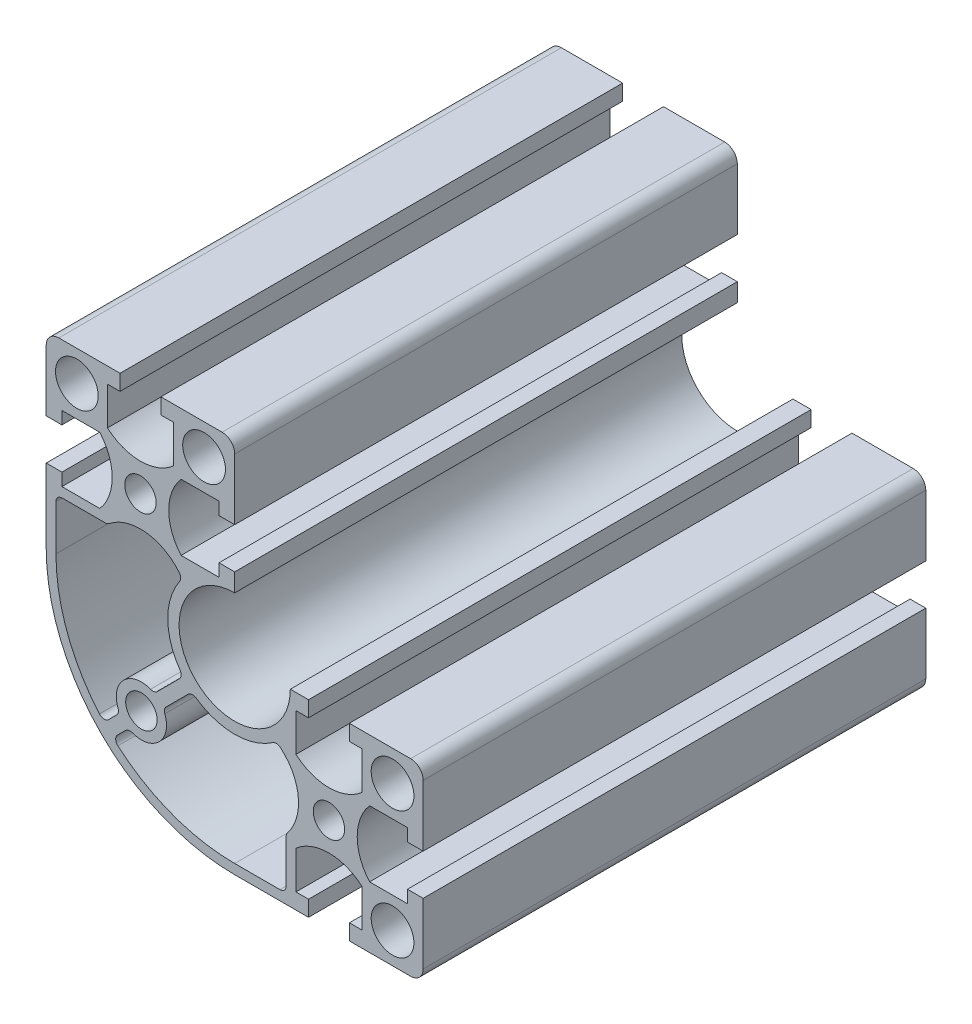
from build123d import *

# Parameters (mm, degrees)
IZIM1_R                     = 3.4
IZIM1_R_2                   = 2.5
Y_KSEKLIK_EKSTR_ZYON1_DEPTH = 80
FILLET1_R                   = 2


with BuildPart() as part:
    # Çizim1 → Yükseklik-Ekstrüzyon1 (new body)
    with BuildSketch(Plane.XY):
        with BuildLine():
            Line((18.25, 0), (30, 0))
            Line((30, 0), (30, -11.75))
            Line((30, -11.75), (27.5, -11.75))
            Line((27.5, -11.75), (27.5, -9.75))
            Line((27.5, -9.75), (21.463651766, -9.75))
            ThreePointArc((21.463651766, -9.75), (19.5, -15), (21.463651766, -20.25))
            Line((21.463651766, -20.25), (27.5, -20.25))
            Line((27.5, -20.25), (27.5, -18.25))
            Line((27.5, -18.25), (30, -18.25))
            Line((30, -18.25), (30, -30))
            Line((30, -30), (18.25, -30))
            Line((18.25, -30), (18.25, -27.5))
            Line((18.25, -27.5), (20.25, -27.5))
            Line((20.25, -27.5), (20.25, -21.463651766))
            ThreePointArc((20.25, -21.463651766), (15, -19.5), (9.75, -21.463651766))
            Line((9.75, -21.463651766), (9.75, -27.5))
            Line((9.75, -27.5), (11.75, -27.5))
            Line((11.75, -27.5), (11.75, -30))
            Line((11.75, -30), (0, -30))
            ThreePointArc((0, -30), (-21.213203436, -21.213203436), (-30, 0))
            Line((-30, 0), (-30, 11.75))
            Line((-30, 11.75), (-27.5, 11.75))
            Line((-27.5, 11.75), (-27.5, 9.75))
            Line((-27.5, 9.75), (-21.463651766, 9.75))
            ThreePointArc((-21.463651766, 9.75), (-19.5, 15), (-21.463651766, 20.25))
            Line((-21.463651766, 20.25), (-27.5, 20.25))
            Line((-27.5, 20.25), (-27.5, 18.25))
            Line((-27.5, 18.25), (-30, 18.25))
            Line((-30, 18.25), (-30, 30))
            Line((-30, 30), (-18.25, 30))
            Line((-18.25, 30), (-18.25, 27.5))
            Line((-18.25, 27.5), (-20.25, 27.5))
            Line((-20.25, 27.5), (-20.25, 21.463651766))
            ThreePointArc((-20.25, 21.463651766), (-15, 19.5), (-9.75, 21.463651766))
            Line((-9.75, 21.463651766), (-9.75, 27.5))
            Line((-9.75, 27.5), (-11.75, 27.5))
            Line((-11.75, 27.5), (-11.75, 30))
            Line((-11.75, 30), (0, 30))
            Line((0, 30), (0, 18.25))
            Line((0, 18.25), (-2.5, 18.25))
            Line((-2.5, 18.25), (-2.5, 20.25))
            Line((-2.5, 20.25), (-8.536348234, 20.25))
            ThreePointArc((-8.536348234, 20.25), (-10.5, 15), (-8.536348234, 9.75))
            Line((-8.536348234, 9.75), (-2.5, 9.75))
            Line((-2.5, 9.75), (-2.5, 11.75))
            Line((-2.5, 11.75), (0, 11.75))
            Line((0, 11.75), (0, 8.85))
            ThreePointArc((0, 8.85), (-6.257895014, -6.257895014), (8.85, 0))
            Line((8.85, 0), (11.75, 0))
            Line((11.75, 0), (11.75, -2.5))
            Line((11.75, -2.5), (9.75, -2.5))
            Line((9.75, -2.5), (9.75, -8.536348234))
            ThreePointArc((9.75, -8.536348234), (15, -10.5), (20.25, -8.536348234))
            Line((20.25, -8.536348234), (20.25, -2.5))
            Line((20.25, -2.5), (18.25, -2.5))
            Line((18.25, -2.5), (18.25, 0))
        make_face()
        with Locations((25.125, -4.875)):
            Circle(IZIM1_R, mode=Mode.SUBTRACT)
        with Locations((25.125, -25.125)):
            Circle(IZIM1_R, mode=Mode.SUBTRACT)
        with Locations((15, -15)):
            Circle(IZIM1_R_2, mode=Mode.SUBTRACT)
        with Locations((-14.849242405, -14.849242405)):
            Circle(IZIM1_R_2, mode=Mode.SUBTRACT)
        with Locations((-4.875, 25.125)):
            Circle(IZIM1_R, mode=Mode.SUBTRACT)
        with Locations((-25.125, 25.125)):
            Circle(IZIM1_R, mode=Mode.SUBTRACT)
        with Locations((-15, 15)):
            Circle(IZIM1_R_2, mode=Mode.SUBTRACT)
        with BuildLine():
            Line((-17.382505973, -18.796719535), (-18.651386187, -20.065599749))
            ThreePointArc((-18.651386187, -20.065599749), (-18.943614734, -20.809160633), (-18.597987217, -21.529453581))
            ThreePointArc((-18.597987217, -21.529453581), (-9.921933925, -26.663790563), (0, -28.45))
            Line((0, -28.45), (7.2, -28.45))
            ThreePointArc((7.2, -28.45), (7.907106781, -28.157106781), (8.2, -27.45))
            Line((8.2, -27.45), (8.2, -20.611577633))
            ThreePointArc((8.2, -20.611577633), (8.256120646, -20.281287208), (8.41818353, -19.988069007))
            ThreePointArc((8.41818353, -19.988069007), (10.119864462, -14.164129468), (7.244983946, -8.820998197))
            ThreePointArc((7.244983946, -8.820998197), (6.652264712, -8.594274715), (6.042451121, -8.769907893))
            ThreePointArc((6.042451121, -8.769907893), (-0.050937117, -10.649878188), (-6.126063635, -8.711707315))
            ThreePointArc((-6.126063635, -8.711707315), (-6.787438159, -8.533426454), (-7.408387658, -8.822601221))
            Line((-7.408387658, -8.822601221), (-10.901765275, -12.315978837))
            ThreePointArc((-10.901765275, -12.315978837), (-11.173564806, -12.818775974), (-11.125575276, -13.388316975))
            ThreePointArc((-11.125575276, -13.388316975), (-12.02081528, -17.67766953), (-16.310167834, -18.572909534))
            ThreePointArc((-16.310167834, -18.572909534), (-16.879708835, -18.524920004), (-17.382505973, -18.796719535))
        make_face(mode=Mode.SUBTRACT)
        with BuildLine():
            Line((-12.315978837, -10.901765275), (-8.822601221, -7.408387658))
            ThreePointArc((-8.822601221, -7.408387658), (-8.533426454, -6.787438159), (-8.711707315, -6.126063635))
            ThreePointArc((-8.711707315, -6.126063635), (-10.649878188, -0.050937117), (-8.769907893, 6.042451121))
            ThreePointArc((-8.769907893, 6.042451121), (-8.594274715, 6.652264712), (-8.820998197, 7.244983946))
            ThreePointArc((-8.820998197, 7.244983946), (-14.164129468, 10.119864462), (-19.988069007, 8.41818353))
            ThreePointArc((-19.988069007, 8.41818353), (-20.281287208, 8.256120646), (-20.611577633, 8.2))
            Line((-20.611577633, 8.2), (-27.45, 8.2))
            ThreePointArc((-27.45, 8.2), (-28.157106781, 7.907106781), (-28.45, 7.2))
            Line((-28.45, 7.2), (-28.45, 0))
            ThreePointArc((-28.45, 0), (-26.663790563, -9.921933925), (-21.529453581, -18.597987217))
            ThreePointArc((-21.529453581, -18.597987217), (-20.809160633, -18.943614734), (-20.065599749, -18.651386187))
            Line((-20.065599749, -18.651386187), (-18.796719535, -17.382505973))
            ThreePointArc((-18.796719535, -17.382505973), (-18.524920004, -16.879708835), (-18.572909534, -16.310167834))
            ThreePointArc((-18.572909534, -16.310167834), (-17.67766953, -12.02081528), (-13.388316975, -11.125575276))
            ThreePointArc((-13.388316975, -11.125575276), (-12.818775974, -11.173564806), (-12.315978837, -10.901765275))
        make_face(mode=Mode.SUBTRACT)
    extrude(amount=Y_KSEKLIK_EKSTR_ZYON1_DEPTH)

    # Fillet1
    fillet1_edges = [part.edges().sort_by_distance(p)[0] for p in [
        (-30, 30, 40),
        (0, 30, 40),
        (30, 0, 40),
        (30, -30, 40),
    ]]
    fillet(fillet1_edges, radius=FILLET1_R)


solid = part.part
